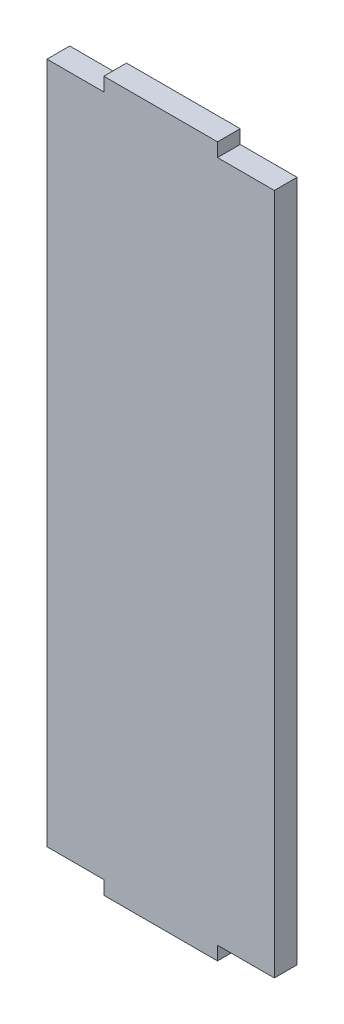
from build123d import *

# Parameters (mm, degrees)
SKETCH1_W           = 50
SKETCH1_H           = 150
BOSS_EXTRUDE1_DEPTH = 5
SKETCH2_W           = 25
SKETCH2_H           = 5
BOSS_EXTRUDE2_DEPTH = 3


with BuildPart() as part:
    # Sketch1 → Boss-Extrude1 (new body)
    with BuildSketch(Plane.XY):
        Rectangle(SKETCH1_W, SKETCH1_H)
    extrude(amount=BOSS_EXTRUDE1_DEPTH)

    # Sketch2 → Boss-Extrude2 (add)
    with BuildSketch(Plane(origin=(0, 75, 0), x_dir=(1, 0, 0), z_dir=(0, 1, 0))):
        with Locations((0, -2.5)):
            Rectangle(SKETCH2_W, SKETCH2_H)
    boss_extrude2 = extrude(amount=BOSS_EXTRUDE2_DEPTH)

    # Mirror1: Boss-Extrude2 across plane
    add(boss_extrude2.mirror(Plane.ZX))


solid = part.part
